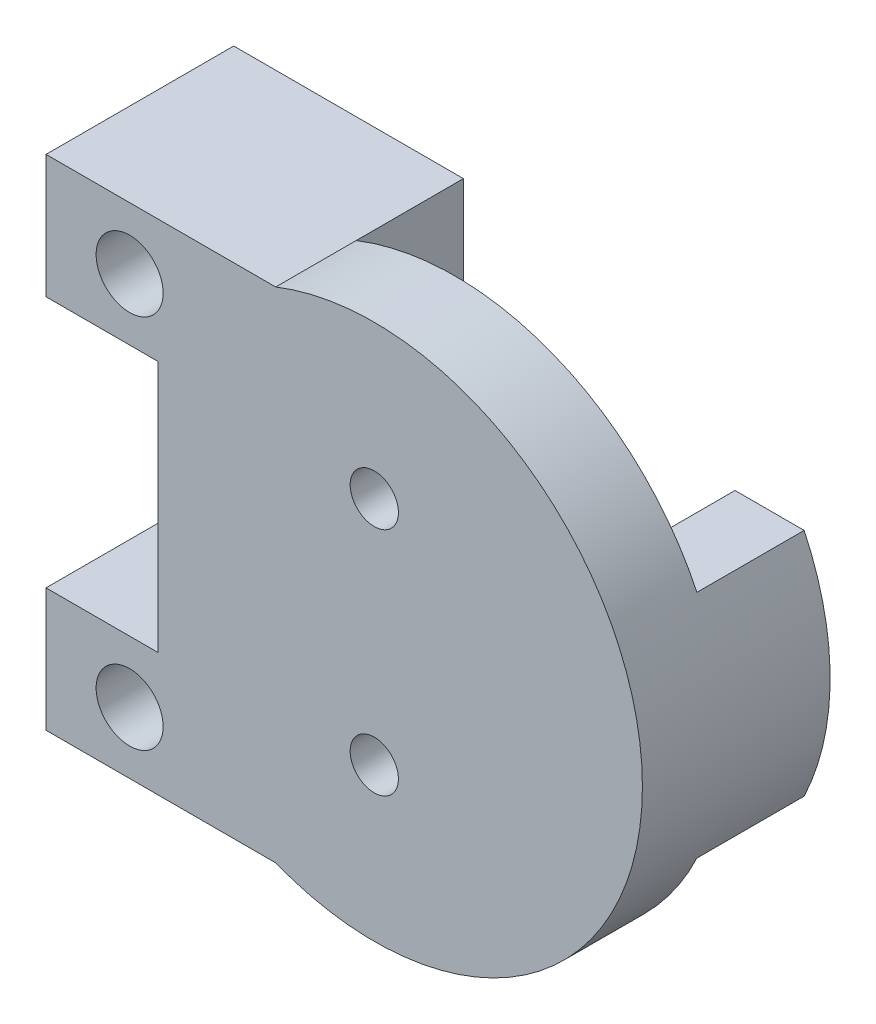
from build123d import *
from build123d.topology import SkipClean

# Parameters (mm, degrees)
SKETCH_1_R      = 1.25
SKETCH_1_R_2    = 0.9
EXTRUDE_1_DEPTH = 3
SKETCH_1_3_R    = 1.4
EXTRUDE_2_DEPTH = 1
EXTRUDE_START   = 4
SKETCH_2_W      = 8.565343767
SKETCH_2_H      = 4.6
SKETCH_2_R      = 1.25
EXTRUDE_3_DEPTH = 4


with BuildPart() as part:
    # 草图1 → 凸台-拉伸1 (new body)
    with BuildSketch(Plane.XY):
        with BuildLine():
            Line((-23.28674194, 37.187768843), (-31.852085707, 37.187768843))
            Line((-31.852085707, 37.187768843), (-31.852085707, 32.587768843))
            Line((-31.852085707, 32.587768843), (-27.669115572, 32.587768843))
            Line((-27.669115572, 32.587768843), (-27.669115572, 23.187768843))
            Line((-27.669115572, 23.187768843), (-31.852085707, 23.187768843))
            Line((-31.852085707, 23.187768843), (-31.852085707, 18.587768843))
            Line((-31.852085707, 18.587768843), (-23.28674194, 18.587768843))
            ThreePointArc((-23.28674194, 18.587768843), (-9.61114675, 27.887768843), (-23.28674194, 37.187768843))
        make_face()
        with Locations((-28.735290545, 20.887768843)):
            Circle(SKETCH_1_R, mode=Mode.SUBTRACT)
        with Locations((-28.735290545, 34.887768843)):
            Circle(SKETCH_1_R, mode=Mode.SUBTRACT)
        with Locations((-19.61114675, 32.187768843)):
            Circle(SKETCH_1_R_2, mode=Mode.SUBTRACT)
        with Locations((-19.61114675, 23.587768843)):
            Circle(SKETCH_1_R_2, mode=Mode.SUBTRACT)
    extrude(amount=EXTRUDE_1_DEPTH)

    # 草图1<3> → 凸台-拉伸2 (add)
    with BuildSketch(Plane.XY):
        with Locations((-25.759188609, 31.787768843)):
            Circle(SKETCH_1_3_R)
        with Locations((-25.759188609, 23.987768843)):
            Circle(SKETCH_1_3_R)
        with Locations((-15.259188609, 23.987768843)):
            Circle(SKETCH_1_3_R)
        with Locations((-15.259188609, 31.787768843)):
            Circle(SKETCH_1_3_R)
    extrude(amount=-EXTRUDE_2_DEPTH)

    # 草图2 → 凸台-拉伸3 (add)
    # profile 1 of 3: a face of its own
    with SkipClean():  # the faces are left unmerged after this step: merging them gives an invalid solid
        with BuildSketch(Plane(origin=(0, 0, 0), x_dir=(-1, 0, 0), z_dir=(0, 0, -1)).offset(EXTRUDE_START)):
            with Locations((27.569413823, 20.887768843)):
                Rectangle(SKETCH_2_W, SKETCH_2_H)
            with Locations((28.735290545, 20.887768843)):
                Circle(SKETCH_2_R, mode=Mode.SUBTRACT)
        # profile 2 of 3: a face of its own
        with BuildSketch(Plane(origin=(0, 0, 0), x_dir=(-1, 0, 0), z_dir=(0, 0, -1)).offset(EXTRUDE_START)):
            with Locations((27.569413823, 34.887768843)):
                Rectangle(SKETCH_2_W, SKETCH_2_H)
            with Locations((28.735290545, 34.887768843)):
                Circle(SKETCH_2_R, mode=Mode.SUBTRACT)
        # profile 3 of 3: a face of its own
        with BuildSketch(Plane(origin=(0, 0, 0), x_dir=(-1, 0, 0), z_dir=(0, 0, -1)).offset(EXTRUDE_START)):
            with BuildLine():
                Line((10.578969282, 32.179594818), (13.158028914, 32.179594818))
                ThreePointArc((13.158028914, 32.179594818), (11.86114675, 27.887768843), (13.158028914, 23.595942869))
                Line((13.158028914, 23.595942869), (10.578969282, 23.595942869))
                ThreePointArc((10.578969282, 23.595942869), (9.61114675, 27.887768843), (10.578969282, 32.179594818))
            make_face()
        extrude(amount=-EXTRUDE_3_DEPTH)


solid = part.part
